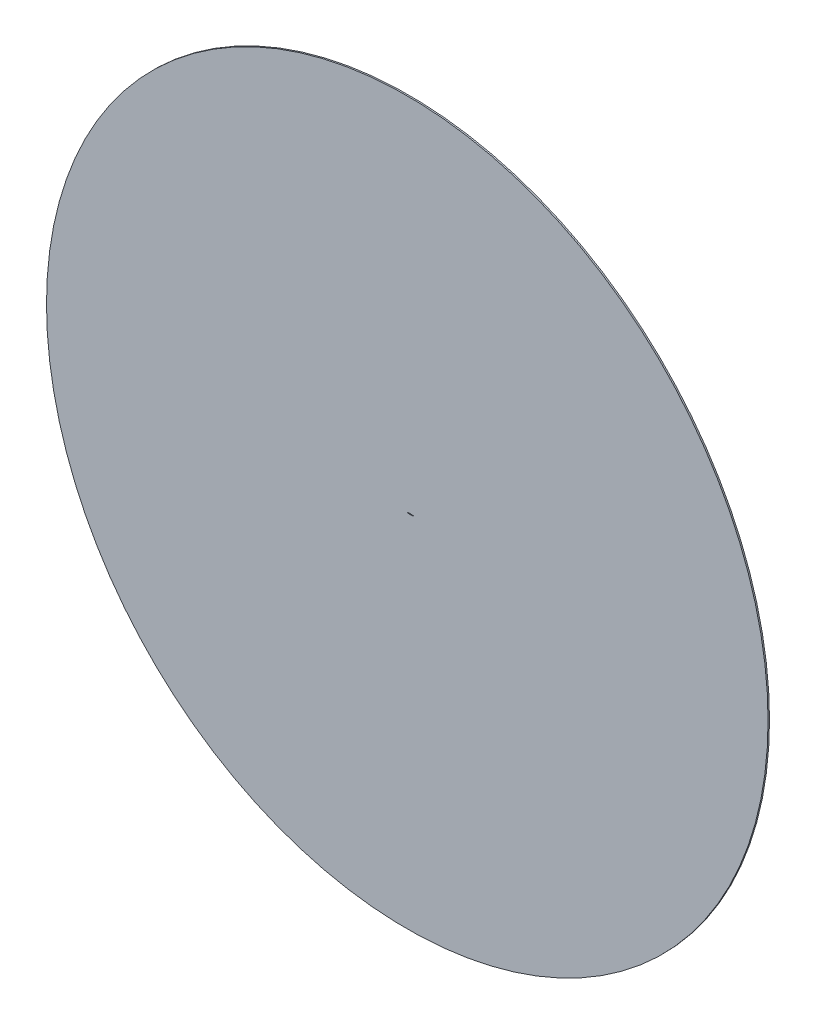
from build123d import *

# Parameters (mm, degrees)
SKETCH1_R           = 30480
BOSS_EXTRUDE1_DEPTH = 121.92


with BuildPart() as part:
    # Sketch1 → Boss-Extrude1 (new body)
    with BuildSketch(Plane.XY):
        Circle(SKETCH1_R)
        with BuildLine():
            add(Edge.make_bspline(
                [(609.6, 0), (609.6, 0.013010457), (609.026600724, 0.064990075), (608.4347679, 0.181226432), (606.982031384, 0.374460393), (605.170832321, 0.642870251), (602.759875483, 0.986789867), (599.853785309, 1.402747774), (596.420052816, 1.889379616), (592.478157133, 2.445307987), (588.030463539, 3.065788999), (583.086436221, 3.749671558), (577.653844905, 4.491908918), (571.742714485, 5.291466865), (565.363317871, 6.143065259), (558.526733427, 7.043517823), (551.245154967, 7.98902077), (543.531080963, 8.975119524), (535.398348035, 9.999505289), (526.860963094, 11.056411479), (517.933767223, 12.14178354), (508.633058212, 13.253409494), (498.974520358, 14.38433784), (488.975527473, 15.53287147), (478.653256963, 16.694176432), (468.025945058, 17.863320976), (457.112240421, 19.035766758), (445.931699122, 20.209646583), (434.503313509, 21.377942122), (422.847428322, 22.538176075), (410.984273273, 23.685048246), (398.934895518, 24.813132922), (386.720444938, 25.920163169), (374.362426444, 26.999080386), (361.882333772, 28.046778458), (349.302073434, 29.058028546), (336.643533948, 30.027033327), (323.929115205, 30.949342713), (311.181344964, 31.81972273), (298.422443523, 32.634120885), (285.674590523, 33.384881258), (272.960120627, 34.070056007), (260.301487745, 34.683286679), (247.72102508, 35.218981726), (235.240711112, 35.673257204), (222.882477128, 36.041636894), (210.66765657, 36.320169072), (198.617970938, 36.503920401), (186.754363143, 36.590823904), (175.097954029, 36.575990555), (163.669045979, 36.45913178), (152.487788738, 36.235407201), (141.573400808, 35.906263597), (130.945292406, 35.467140821), (120.622029775, 34.920473338), (110.621959439, 34.264605759), (100.962368247, 33.500231737), (91.660176513, 32.62997896), (82.731554181, 31.654087288), (74.192455883, 30.575657263), (66.057555419, 29.397939426), (58.341318498, 28.122367188), (51.056870419, 26.754847648), (44.217055549, 25.297548182), (37.833502902, 23.756162913), (31.917638651, 22.13293195), (26.478630576, 20.435907109), (21.526673014, 18.666192998), (17.068919215, 16.83006339), (13.11270468, 14.930718349), (9.663133894, 12.97297966), (6.725593648, 10.957725672), (4.302915856, 8.886224887), (2.399833789, 6.755793531), (1.02186516, 4.562630438), (0.185865427, 2.302809207), (-0.091243216, 0), (0.185865427, -2.302809207), (1.02186516, -4.562630438), (2.399833789, -6.755793531), (4.302915856, -8.886224887), (6.725593648, -10.957725672), (9.663133894, -12.97297966), (13.11270468, -14.930718349), (17.068919215, -16.83006339), (21.526673014, -18.666192998), (26.478630576, -20.435907109), (31.917638651, -22.13293195), (37.833502902, -23.756162913), (44.217055549, -25.297548182), (51.056870419, -26.754847648), (58.341318498, -28.122367188), (66.057555419, -29.397939426), (74.192455883, -30.575657263), (82.731554181, -31.654087288), (91.660176513, -32.62997896), (100.962368247, -33.500231737), (110.621959439, -34.264605759), (120.622029775, -34.920473338), (130.945292406, -35.467140821), (141.573400808, -35.906263597), (152.487788738, -36.235407201), (163.669045979, -36.45913178), (175.097954029, -36.575990555), (186.754363143, -36.590823904), (198.617970938, -36.503920401), (210.66765657, -36.320169072), (222.882477128, -36.041636894), (235.240711112, -35.673257204), (247.72102508, -35.218981726), (260.301487745, -34.683286679), (272.960120627, -34.070056007), (285.674590523, -33.384881258), (298.422443523, -32.634120885), (311.181344964, -31.81972273), (323.929115205, -30.949342713), (336.643533948, -30.027033327), (349.302073434, -29.058028546), (361.882333772, -28.046778458), (374.362426444, -26.999080386), (386.720444938, -25.920163169), (398.934895518, -24.813132922), (410.984273273, -23.685048246), (422.847428322, -22.538176075), (434.503313509, -21.377942122), (445.931699122, -20.209646583), (457.112240421, -19.035766758), (468.025945058, -17.863320976), (478.653256963, -16.694176432), (488.975527473, -15.53287147), (498.974520358, -14.38433784), (508.633058212, -13.253409494), (517.933767223, -12.14178354), (526.860963094, -11.056411479), (535.398348035, -9.999505289), (543.531080963, -8.975119524), (551.245154967, -7.98902077), (558.526733427, -7.043517823), (565.363317871, -6.143065259), (571.742714485, -5.291466865), (577.653844905, -4.491908918), (583.086436221, -3.749671558), (588.030463539, -3.065788999), (592.478157133, -2.445307987), (596.420052816, -1.889379616), (599.853785309, -1.402747774), (602.759875483, -0.986789867), (605.170832321, -0.642870251), (606.982031384, -0.374460393), (608.4347679, -0.181226432), (609.026600724, -0.064990075), (609.6, -0.013010457), (609.6, 0)],
                knots=[0, 0, 0, 0, 0.000217527, 0.00086907, 0.001953586, 0.003468994, 0.005412798, 0.007781324, 0.010570481, 0.013775211, 0.017389281, 0.021406114, 0.025819, 0.030619912, 0.035799654, 0.041349103, 0.047259146, 0.05351769, 0.06011472, 0.067038584, 0.074275753, 0.081814769, 0.089641026, 0.09774113, 0.106101094, 0.114705909, 0.123539657, 0.132587505, 0.141832961, 0.151260184, 0.160852267, 0.170592322, 0.180462588, 0.190446649, 0.200525754, 0.210683083, 0.220900825, 0.231160257, 0.241443665, 0.251732878, 0.26201019, 0.27225757, 0.282457436, 0.292591289, 0.302641712, 0.312592332, 0.322424883, 0.332123631, 0.34167147, 0.351052361, 0.360250359, 0.369250607, 0.378037834, 0.386598392, 0.394917693, 0.402982299, 0.410779844, 0.418298526, 0.425525784, 0.432452085, 0.439066112, 0.44535884, 0.451322798, 0.456949062, 0.462232027, 0.46716687, 0.471749135, 0.475977205, 0.479852091, 0.483377313, 0.486560002, 0.489413867, 0.491960638, 0.494233583, 0.496281471, 0.498174536, 0.5, 0.501825464, 0.503718529, 0.505766417, 0.508039362, 0.510586133, 0.513439998, 0.516622687, 0.520147909, 0.524022795, 0.528250865, 0.53283313, 0.537767973, 0.543050938, 0.548677202, 0.55464116, 0.560933888, 0.567547915, 0.574474216, 0.581701474, 0.589220156, 0.597017701, 0.605082307, 0.613401608, 0.621962166, 0.630749393, 0.639749641, 0.648947639, 0.65832853, 0.667876369, 0.677575117, 0.687407668, 0.697358288, 0.707408711, 0.717542564, 0.72774243, 0.73798981, 0.748267122, 0.758556335, 0.768839743, 0.779099175, 0.789316917, 0.799474246, 0.809553351, 0.819537412, 0.829407678, 0.839147733, 0.848739816, 0.858167039, 0.867412495, 0.876460343, 0.885294091, 0.893898906, 0.90225887, 0.910358974, 0.918185231, 0.925724247, 0.932961416, 0.93988528, 0.94648231, 0.952740854, 0.958650897, 0.964200346, 0.969380088, 0.974181, 0.978593886, 0.982610719, 0.986224789, 0.989429519, 0.992218676, 0.994587202, 0.996531006, 0.998046414, 0.99913093, 0.999782473, 1, 1, 1, 1], degree=3))
        make_face(mode=Mode.SUBTRACT)
    extrude(amount=BOSS_EXTRUDE1_DEPTH)


solid = part.part
